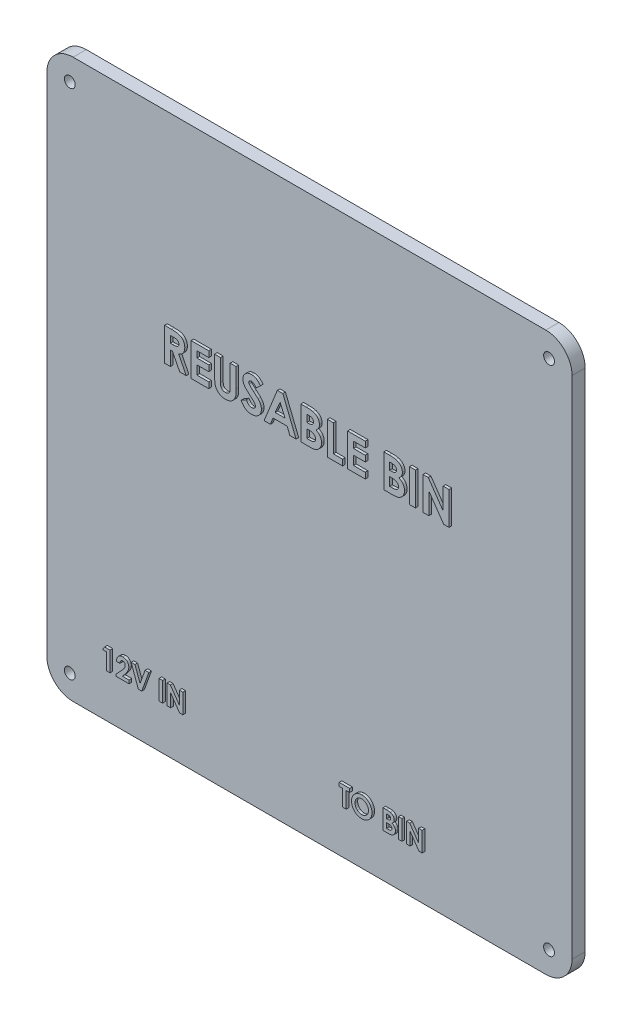
from build123d import *

# Parameters (mm, degrees)
LID_DEPTH           = 4
SKETCH2_R           = 1.65
SCREW_HOLES_DEPTH   = 188.92551716
SKETCH3_W           = 30
SKETCH3_H           = 2
SKETCH3_W_2         = 2
SKETCH3_H_2         = 30
LOCATING_TABS_DEPTH = 3
SKETCH4_W           = 1.794871795
SKETCH4_H           = 10
SKETCH4_W_2         = 1.076923077
SKETCH4_H_2         = 6
LABELS_RAISED_DEPTH = 0.8


with BuildPart() as part:
    # Sketch1 → Lid (new body)
    with BuildSketch(Plane.XY):
        with BuildLine():
            Line((-72, 0), (72, 0))
            ThreePointArc((72, 0), (77.656854249, 2.343145751), (80, 8))
            Line((80, 8), (80, 162))
            ThreePointArc((80, 162), (77.656854249, 167.656854249), (72, 170))
            Line((72, 170), (-72, 170))
            ThreePointArc((-72, 170), (-77.656854249, 167.656854249), (-80, 162))
            Line((-80, 162), (-80, 8))
            ThreePointArc((-80, 8), (-77.656854249, 2.343145751), (-72, 0))
        make_face()
    extrude(amount=LID_DEPTH)

    # Sketch2 → Screw holes (cut, through all)
    with BuildSketch(Plane.XY):
        with Locations((-73, 7)):
            Circle(SKETCH2_R)
        with Locations((73, 7)):
            Circle(SKETCH2_R)
        with Locations((-73, 163)):
            Circle(SKETCH2_R)
        with Locations((73, 163)):
            Circle(SKETCH2_R)
    extrude(amount=SCREW_HOLES_DEPTH, mode=Mode.SUBTRACT)

    # Sketch3 → Locating tabs (add)
    with BuildSketch(Plane.XY.offset(-3)):
        with Locations((0, 4.3)):
            Rectangle(SKETCH3_W, SKETCH3_H)
        with Locations((0, 165.7)):
            Rectangle(SKETCH3_W, SKETCH3_H)
        with Locations((-75.7, 85)):
            Rectangle(SKETCH3_W_2, SKETCH3_H_2)
        with Locations((75.7, 85)):
            Rectangle(SKETCH3_W_2, SKETCH3_H_2)
    extrude(amount=LOCATING_TABS_DEPTH)

    # Sketch4 → Labels (raised) (add)
    # profile 1 of 21: a face of its own
    with BuildSketch(Plane.XY.offset(4)):
        with BuildLine():
            Line((-43.333333333, 114), (-41.241987179, 114))
            add(Edge.make_bspline(
                [(-41.241987179, 114), (-41.103749835, 113.999509337), (-40.837880483, 113.998565653), (-40.454511399, 113.983676825), (-40.102334173, 113.9629578), (-39.780827375, 113.931340016), (-39.490128552, 113.889418657), (-39.229946354, 113.840000312), (-39.000288388, 113.783677513), (-38.799217805, 113.713494862), (-38.617761546, 113.634329895), (-38.448619086, 113.543367897), (-38.288058889, 113.441621757), (-38.137154129, 113.32641426), (-37.994593406, 113.19981796), (-37.860107772, 113.061705426), (-37.735597632, 112.91090552), (-37.62183396, 112.748371106), (-37.51814753, 112.577388629), (-37.426510473, 112.39772333), (-37.351991066, 112.209250263), (-37.286145181, 112.014693272), (-37.238718523, 111.811271126), (-37.205733977, 111.600964175), (-37.181583982, 111.383032114), (-37.180195473, 111.234978749), (-37.179487179, 111.159455128)],
                knots=[0, 0, 0, 0, 1.749336639, 3.364467119, 4.854658419, 6.213483162, 7.451590619, 8.570285859, 9.5643256, 10.440900261, 11.26203566, 12.067320669, 12.869050712, 13.665104639, 14.467235401, 15.27997916, 16.102287765, 16.939272006, 17.78853747, 18.631303466, 19.488103222, 20.351255419, 21.228522269, 22.127379805, 23.044756219, 24, 24, 24, 24], degree=3))
            add(Edge.make_bspline(
                [(-37.179487179, 111.159455128), (-37.181327071, 111.080625818), (-37.184934764, 110.926055908), (-37.20436776, 110.699005317), (-37.239885172, 110.481779192), (-37.293681459, 110.275013547), (-37.355513304, 110.07613494), (-37.437733797, 109.888812806), (-37.530527749, 109.710322818), (-37.640736416, 109.543189782), (-37.761685043, 109.383701341), (-37.902345752, 109.237968087), (-38.05360589, 109.098157412), (-38.223968339, 108.973026581), (-38.405923366, 108.854114699), (-38.603086224, 108.746348867), (-38.814170162, 108.647020099), (-38.962572624, 108.591627517), (-39.038461538, 108.563301282)],
                knots=[0, 0, 0, 0, 1.099860209, 2.156625411, 3.176576793, 4.16617041, 5.135385252, 6.078461593, 7.016046972, 7.938469504, 8.868247731, 9.803980173, 10.76021508, 11.73834243, 12.748633912, 13.790971185, 14.870363756, 16, 16, 16, 16], degree=3))
            Line((-39.038461538, 108.563301282), (-36.730769231, 104))
            Line((-36.730769231, 104), (-38.725961538, 104))
            Line((-38.725961538, 104), (-40.929487179, 108.358974359))
            Line((-40.929487179, 108.358974359), (-41.538461538, 108.358974359))
            Line((-41.538461538, 108.358974359), (-41.538461538, 104))
            Line((-41.538461538, 104), (-43.333333333, 104))
            Line((-43.333333333, 104), (-43.333333333, 114))
        make_face()
        with BuildLine():
            Line((-41.538461538, 110.153846154), (-40.839342949, 110.153846154))
            add(Edge.make_bspline(
                [(-40.839342949, 110.153846154), (-40.75386989, 110.154808809), (-40.590207348, 110.156652086), (-40.354839116, 110.165201972), (-40.14106863, 110.185802971), (-39.947977886, 110.211831563), (-39.774595269, 110.241885331), (-39.622467292, 110.284954206), (-39.489249893, 110.331103596), (-39.376521704, 110.388455316), (-39.280209331, 110.453676661), (-39.19704976, 110.52776973), (-39.128264872, 110.613523023), (-39.0716514, 110.708606135), (-39.027612274, 110.813860053), (-38.995467086, 110.928129328), (-38.97750268, 111.052715634), (-38.975435813, 111.138697148), (-38.974358974, 111.18349359)],
                knots=[0, 0, 0, 0, 1.688639943, 3.233382647, 4.650958383, 5.928841754, 7.082724185, 8.122798841, 9.049171256, 9.863274652, 10.613301712, 11.341792392, 12.054588806, 12.776240173, 13.521029143, 14.301969904, 15.115324896, 16, 16, 16, 16], degree=3))
            add(Edge.make_bspline(
                [(-38.974358974, 111.18349359), (-38.976394837, 111.23649105), (-38.980393912, 111.34059474), (-39.020077162, 111.49046755), (-39.083244324, 111.62918509), (-39.169829202, 111.7561206), (-39.278871599, 111.86740103), (-39.404006353, 111.965495615), (-39.547934173, 112.043061474), (-39.681200504, 112.094223088), (-39.802441716, 112.12483361), (-39.911858084, 112.1476443), (-40.038562897, 112.16381089), (-40.18265181, 112.180958437), (-40.343757536, 112.192077754), (-40.522758197, 112.200192638), (-40.719139705, 112.203512836), (-40.856036267, 112.204574245), (-40.927483974, 112.205128205)],
                knots=[0, 0, 0, 0, 1.020303359, 2.004196876, 2.966617323, 3.9489082, 4.950758222, 5.960522915, 7.003732012, 8.091992268, 8.70421221, 9.413913587, 10.24622431, 11.166358409, 12.212345909, 13.359657661, 14.621978493, 16, 16, 16, 16], degree=3))
            Line((-40.927483974, 112.205128205), (-41.538461538, 112.205128205))
            Line((-41.538461538, 112.205128205), (-41.538461538, 110.153846154))
        make_face(mode=Mode.SUBTRACT)
    # profile 2 of 21: a face of its own
    with BuildSketch(Plane.XY.offset(4)):
        Polygon((-35.256410256, 114), (-29.871794872, 114), (-29.871794872, 112.205128205), (-33.461538462, 112.205128205), (-33.461538462, 110.282051282), (-29.871794872, 110.282051282), (-29.871794872, 108.487179487), (-33.461538462, 108.487179487), (-33.461538462, 105.794871795), (-29.871794872, 105.794871795), (-29.871794872, 104), (-35.256410256, 104), align=None)
    # profile 3 of 21: a face of its own
    with BuildSketch(Plane.XY.offset(4)):
        with BuildLine():
            Line((-28.076923077, 114), (-26.282051282, 114))
            Line((-26.282051282, 114), (-26.282051282, 107.493589744))
            add(Edge.make_bspline(
                [(-26.282051282, 107.493589744), (-26.281953686, 107.426134104), (-26.28176518, 107.295844233), (-26.272328461, 107.108920926), (-26.263693213, 106.937099269), (-26.248112774, 106.780567371), (-26.225095126, 106.639258272), (-26.202806531, 106.512264253), (-26.172641123, 106.401858998), (-26.127307337, 106.276188913), (-26.057462854, 106.134991709), (-25.943340845, 105.987832744), (-25.811653809, 105.853528829), (-25.653819312, 105.741739338), (-25.476427295, 105.651311716), (-25.280452449, 105.584314856), (-25.066171029, 105.547073497), (-24.918007182, 105.541387922), (-24.841746795, 105.538461538)],
                knots=[0, 0, 0, 0, 1.155499968, 2.231836252, 3.205919964, 4.102923608, 4.924856345, 5.658536265, 6.31071849, 6.882491295, 7.94666036, 8.992281882, 10.060072772, 11.158554251, 12.289267114, 13.461410017, 14.693379945, 16, 16, 16, 16], degree=3))
            add(Edge.make_bspline(
                [(-24.841746795, 105.538461538), (-24.760729545, 105.54082568), (-24.602759623, 105.545435357), (-24.37554504, 105.590684323), (-24.165029439, 105.662736173), (-23.975670155, 105.765572525), (-23.807655631, 105.888839917), (-23.665434857, 106.029403371), (-23.553194745, 106.187543242), (-23.480040815, 106.333439316), (-23.438968486, 106.467723947), (-23.40818273, 106.587702169), (-23.385613364, 106.729264595), (-23.365137694, 106.890200422), (-23.352833394, 107.072176636), (-23.339491386, 107.27372976), (-23.334601417, 107.496238875), (-23.333767957, 107.651176147), (-23.333333333, 107.731971154)],
                knots=[0, 0, 0, 0, 1.261321664, 2.459363699, 3.594844139, 4.716940403, 5.803436589, 6.833651888, 7.818396249, 8.814403945, 9.360733334, 10.004355033, 10.743453831, 11.592799886, 12.532235708, 13.585170094, 14.740740724, 16, 16, 16, 16], degree=3))
            Line((-23.333333333, 107.731971154), (-23.333333333, 114))
            Line((-23.333333333, 114), (-21.538461538, 114))
            Line((-21.538461538, 114), (-21.538461538, 108.034455128))
            add(Edge.make_bspline(
                [(-21.538461538, 108.034455128), (-21.538710789, 107.913593474), (-21.539190074, 107.681188301), (-21.546550439, 107.347205712), (-21.562219326, 107.04216619), (-21.575379384, 106.765980603), (-21.600848602, 106.51902102), (-21.627381553, 106.300232852), (-21.661200082, 106.110391434), (-21.711520019, 105.894280051), (-21.798357333, 105.645435708), (-21.938350468, 105.358902234), (-22.116062692, 105.078368607), (-22.326109659, 104.80692089), (-22.563271899, 104.554754709), (-22.822291016, 104.333385442), (-23.099051842, 104.146130913), (-23.396446328, 103.997569721), (-23.714221376, 103.881703191), (-24.055521134, 103.803846719), (-24.420112861, 103.751245909), (-24.671943258, 103.746192954), (-24.801682692, 103.743589744)],
                knots=[0, 0, 0, 0, 1.170808336, 2.251350247, 3.235597562, 4.129743112, 4.929140599, 5.639994148, 6.264258765, 6.79612947, 7.788252245, 8.809469599, 9.879094798, 10.999557536, 12.129761673, 13.226370002, 14.293821979, 15.358369427, 16.438775801, 17.562147481, 18.744053101, 20, 20, 20, 20], degree=3))
            add(Edge.make_bspline(
                [(-24.801682692, 103.743589744), (-24.887884153, 103.745041693), (-25.057957868, 103.74790636), (-25.308081101, 103.773165241), (-25.54987434, 103.810387334), (-25.782883256, 103.864690535), (-26.00791658, 103.934840127), (-26.224914526, 104.02118939), (-26.433070678, 104.123256678), (-26.631220222, 104.240103194), (-26.819119318, 104.366452585), (-26.990849393, 104.506516205), (-27.152320082, 104.649935818), (-27.298866563, 104.802747132), (-27.431589532, 104.963345888), (-27.550215644, 105.132096055), (-27.654568662, 105.308982645), (-27.747273528, 105.497194028), (-27.826619845, 105.706296308), (-27.893511772, 105.943727341), (-27.951950133, 106.21320862), (-27.995378074, 106.515347273), (-28.034750101, 106.849147484), (-28.059670424, 107.215478854), (-28.072707366, 107.614351893), (-28.075482332, 107.890882302), (-28.076923077, 108.034455128)],
                knots=[0, 0, 0, 0, 1.001158378, 1.975264943, 2.917723546, 3.841610987, 4.75185031, 5.653588123, 6.552117133, 7.442167995, 8.324307438, 9.179605724, 10.014504199, 10.831958861, 11.636465792, 12.43274043, 13.225645099, 14.020104002, 14.867201867, 15.819789774, 16.883317127, 18.068162734, 19.364263498, 20.787406516, 22.332041935, 24, 24, 24, 24], degree=3))
            Line((-28.076923077, 108.034455128), (-28.076923077, 114))
        make_face()
    # profile 4 of 21: a face of its own
    with BuildSketch(Plane.XY.offset(4)):
        with BuildLine():
            Line((-14.102564103, 112.663862179), (-15.444711538, 111.435897436))
            add(Edge.make_bspline(
                [(-15.444711538, 111.435897436), (-15.50220338, 111.516995655), (-15.612579697, 111.672692925), (-15.791488195, 111.881175241), (-15.96958883, 112.059026171), (-16.148531595, 112.205502736), (-16.329902571, 112.319714983), (-16.513386924, 112.400578516), (-16.697944431, 112.451984231), (-16.821938587, 112.45838548), (-16.883012821, 112.461538462)],
                knots=[0, 0, 0, 0, 1.299362458, 2.494594718, 3.587462134, 4.587049575, 5.512617175, 6.380583204, 7.202344345, 8, 8, 8, 8], degree=3))
            add(Edge.make_bspline(
                [(-16.883012821, 112.461538462), (-16.939981114, 112.459540588), (-17.04997192, 112.455683218), (-17.206771975, 112.417341249), (-17.345981297, 112.351168643), (-17.467464023, 112.264642393), (-17.563696266, 112.160398321), (-17.640530249, 112.051073094), (-17.683794238, 111.930402767), (-17.68948863, 111.847521519), (-17.692307692, 111.806490385)],
                knots=[0, 0, 0, 0, 1.185010067, 2.2879431, 3.333075148, 4.379039566, 5.372662701, 6.27520591, 7.14612461, 8, 8, 8, 8], degree=3))
            add(Edge.make_bspline(
                [(-17.692307692, 111.806490385), (-17.690541129, 111.764867563), (-17.686983516, 111.681044985), (-17.65262182, 111.558192557), (-17.600828931, 111.438151434), (-17.551338712, 111.36507669), (-17.526041667, 111.327724359)],
                knots=[0, 0, 0, 0, 0.967525499, 1.948461899, 2.951351359, 4, 4, 4, 4], degree=3))
            add(Edge.make_bspline(
                [(-17.526041667, 111.327724359), (-17.503043916, 111.298690783), (-17.450106132, 111.231859325), (-17.349164621, 111.126008713), (-17.222403281, 110.996332448), (-17.064944071, 110.847289717), (-16.883323555, 110.67352036), (-16.669123387, 110.481855318), (-16.428509183, 110.266358945), (-16.257486182, 110.116295075), (-16.16786859, 110.037660256)],
                knots=[0, 0, 0, 0, 0.473873513, 1.090794244, 1.870441696, 2.795289791, 3.865433203, 5.087734844, 6.473946851, 8, 8, 8, 8], degree=3))
            add(Edge.make_bspline(
                [(-16.16786859, 110.037660256), (-16.083749588, 109.964859504), (-15.9241092, 109.8266988), (-15.696972629, 109.630601864), (-15.497357413, 109.454178233), (-15.322355613, 109.300075646), (-15.174620085, 109.166677216), (-15.053529749, 109.0533453), (-14.957605692, 108.962286261), (-14.903078483, 108.907286546), (-14.879807692, 108.883814103)],
                knots=[0, 0, 0, 0, 1.543621617, 2.929473131, 4.163658386, 5.240097082, 6.164993805, 6.925417477, 7.541396219, 8, 8, 8, 8], degree=3))
            add(Edge.make_bspline(
                [(-14.879807692, 108.883814103), (-14.791523165, 108.788271337), (-14.6218093, 108.604604587), (-14.401241103, 108.319978887), (-14.219706343, 108.042126168), (-14.07926761, 107.76581818), (-13.97320263, 107.487068348), (-13.898425414, 107.199040348), (-13.853640842, 106.898724467), (-13.848668709, 106.693795541), (-13.846153846, 106.590144231)],
                knots=[0, 0, 0, 0, 1.206664779, 2.319633467, 3.337109185, 4.282041471, 5.190008762, 6.099243693, 7.03861361, 8, 8, 8, 8], degree=3))
            add(Edge.make_bspline(
                [(-13.846153846, 106.590144231), (-13.847943861, 106.489148741), (-13.851455937, 106.290991831), (-13.89447213, 106.00101871), (-13.955810697, 105.723501848), (-14.050650882, 105.461461021), (-14.166241538, 105.210594909), (-14.31115112, 104.974811208), (-14.481327553, 104.751723691), (-14.676375876, 104.545320319), (-14.892122481, 104.358023566), (-15.12353122, 104.191287572), (-15.372864923, 104.053625771), (-15.637993322, 103.940271097), (-15.9187745, 103.852963811), (-16.214873963, 103.78843559), (-16.526744614, 103.749706769), (-16.740006259, 103.74565813), (-16.848958333, 103.743589744)],
                knots=[0, 0, 0, 0, 1.043214005, 2.046824704, 3.02475056, 3.976699089, 4.921714032, 5.875962561, 6.831408892, 7.817874052, 8.806269674, 9.781291748, 10.760897367, 11.74438705, 12.757449933, 13.795994037, 14.874007457, 16, 16, 16, 16], degree=3))
            add(Edge.make_bspline(
                [(-16.848958333, 103.743589744), (-16.934484784, 103.74510704), (-17.103876206, 103.748112156), (-17.353533553, 103.772646433), (-17.594605944, 103.812242144), (-17.826821832, 103.868994627), (-18.051227391, 103.940907721), (-18.267831836, 104.028746809), (-18.475139876, 104.133873366), (-18.674720102, 104.254125571), (-18.865602306, 104.393754221), (-19.05020012, 104.549904654), (-19.226679943, 104.724978534), (-19.395889372, 104.918561817), (-19.556745757, 105.131202685), (-19.714514505, 105.359939721), (-19.862183898, 105.609017972), (-19.953405851, 105.783748381), (-20, 105.872996795)],
                knots=[0, 0, 0, 0, 1.016823716, 2.013894106, 2.979844003, 3.91962641, 4.853723003, 5.779685073, 6.695824784, 7.614987388, 8.547259901, 9.504950863, 10.487499108, 11.500346958, 12.559593716, 13.656357062, 14.802919212, 16, 16, 16, 16], degree=3))
            Line((-20, 105.872996795), (-18.421474359, 106.820512821))
            add(Edge.make_bspline(
                [(-18.421474359, 106.820512821), (-18.363192043, 106.71920421), (-18.251459862, 106.524986944), (-18.062119235, 106.264031433), (-17.86814943, 106.040566233), (-17.665066037, 105.858541107), (-17.455338475, 105.715522145), (-17.23795371, 105.613310873), (-17.012759013, 105.550042211), (-16.859366616, 105.542315646), (-16.782852564, 105.538461538)],
                knots=[0, 0, 0, 0, 1.283663364, 2.460892379, 3.537111102, 4.529833553, 5.449777664, 6.316464042, 7.160231139, 8, 8, 8, 8], degree=3))
            add(Edge.make_bspline(
                [(-16.782852564, 105.538461538), (-16.705026819, 105.541609012), (-16.554033538, 105.547715568), (-16.338509951, 105.604119988), (-16.140909766, 105.692679066), (-15.970105625, 105.819040658), (-15.825479448, 105.964881141), (-15.718737028, 106.127135347), (-15.65168072, 106.30269048), (-15.644591242, 106.424642624), (-15.641025641, 106.485977564)],
                knots=[0, 0, 0, 0, 1.13588714, 2.203786484, 3.234766741, 4.283437687, 5.291419208, 6.222934724, 7.106237994, 8, 8, 8, 8], degree=3))
            add(Edge.make_bspline(
                [(-15.641025641, 106.485977564), (-15.644318328, 106.543039745), (-15.651007105, 106.658956103), (-15.700274579, 106.831305087), (-15.777294668, 107.00357569), (-15.868414864, 107.1448767), (-15.961141074, 107.263184205), (-16.049808245, 107.365692306), (-16.157781403, 107.478945813), (-16.284786778, 107.603087188), (-16.429146295, 107.73920928), (-16.59098156, 107.88729876), (-16.772145758, 108.046051136), (-16.90019297, 108.154191686), (-16.967147436, 108.210737179)],
                knots=[0, 0, 0, 0, 0.916159276, 1.861089862, 2.860218735, 3.940849679, 4.552606315, 5.27541173, 6.11797699, 7.06649574, 8.129236253, 9.306560635, 10.591630461, 12, 12, 12, 12], degree=3))
            add(Edge.make_bspline(
                [(-16.967147436, 108.210737179), (-17.09443054, 108.318430891), (-17.338725342, 108.52512772), (-17.683944892, 108.830412429), (-17.995018617, 109.115728962), (-18.26925975, 109.384604457), (-18.510162548, 109.632073404), (-18.716095512, 109.860145843), (-18.884796375, 110.070581039), (-19.062317657, 110.319827446), (-19.230998368, 110.62355132), (-19.37678637, 110.98896635), (-19.471367472, 111.354335014), (-19.481963969, 111.599623411), (-19.487179487, 111.720352564)],
                knots=[0, 0, 0, 0, 1.345494975, 2.582412109, 3.71882943, 4.751509156, 5.681369928, 6.505683931, 7.230279997, 7.856715994, 8.973648664, 10.023341002, 11.027102913, 12, 12, 12, 12], degree=3))
            add(Edge.make_bspline(
                [(-19.487179487, 111.720352564), (-19.48501036, 111.805967199), (-19.480736947, 111.974637228), (-19.44261744, 112.222641928), (-19.385646385, 112.461945626), (-19.302908057, 112.691675233), (-19.195523698, 112.911543002), (-19.065109565, 113.122625279), (-18.909640574, 113.322979311), (-18.734437517, 113.512472276), (-18.541408604, 113.685647283), (-18.335132681, 113.838491578), (-18.116777287, 113.967586092), (-17.887678209, 114.074679366), (-17.646415817, 114.156652463), (-17.394767479, 114.214759081), (-17.132372251, 114.249319044), (-16.953896681, 114.25401707), (-16.862980769, 114.256410256)],
                knots=[0, 0, 0, 0, 1.010766082, 1.991317756, 2.957454644, 3.913069143, 4.869106762, 5.843196583, 6.838735724, 7.860187025, 8.887984031, 9.89767229, 10.887916223, 11.879572884, 12.879850636, 13.892031539, 14.926195476, 16, 16, 16, 16], degree=3))
            add(Edge.make_bspline(
                [(-16.862980769, 114.256410256), (-16.745158247, 114.252100058), (-16.510443254, 114.243513683), (-16.163410366, 114.17637104), (-15.82444315, 114.070782161), (-15.551297015, 113.943400796), (-15.333959734, 113.820006407), (-15.16739101, 113.706400397), (-14.997898368, 113.576258607), (-14.824114954, 113.429170925), (-14.649269934, 113.262366027), (-14.468391627, 113.079814835), (-14.283944722, 112.879939678), (-14.164083478, 112.737149793), (-14.102564103, 112.663862179)],
                knots=[0, 0, 0, 0, 1.282922637, 2.555718331, 3.837320111, 5.142675274, 5.830281639, 6.55870424, 7.337177975, 8.157850921, 9.037902056, 9.96903443, 10.957596896, 12, 12, 12, 12], degree=3))
        make_face()
    # profile 5 of 21: a face of its own
    with BuildSketch(Plane.XY.offset(4)):
        Polygon((-8.976362179, 114), (-7.307692308, 114), (-3.269230769, 104), (-5.186298077, 104), (-5.963541667, 106.051282051), (-10.31650641, 106.051282051), (-11.095753205, 104), (-13.012820513, 104), align=None)
        Polygon((-8.141025641, 111.317708333), (-9.635416667, 107.846153846), (-6.64463141, 107.846153846), align=None, mode=Mode.SUBTRACT)
    # profile 6 of 21: a face of its own
    with BuildSketch(Plane.XY.offset(4)):
        with BuildLine():
            Line((-1.794871795, 104), (-1.794871795, 114))
            Line((-1.794871795, 114), (-0.192307692, 114))
            add(Edge.make_bspline(
                [(-0.192307692, 114), (-0.080118185, 114.000012804), (0.136966385, 114.000037578), (0.450162766, 113.98903915), (0.740625959, 113.97481145), (1.007431598, 113.958893963), (1.251033804, 113.931464952), (1.471062141, 113.902557771), (1.667956226, 113.867697492), (1.78968514, 113.836426741), (1.846955128, 113.821714744)],
                knots=[0, 0, 0, 0, 1.311965854, 2.538629056, 3.664479157, 4.713267157, 5.663616078, 6.530575999, 7.308677837, 8, 8, 8, 8], degree=3))
            add(Edge.make_bspline(
                [(1.846955128, 113.821714744), (1.922156438, 113.800963209), (2.069725549, 113.760242035), (2.28109161, 113.678003865), (2.481601802, 113.586590309), (2.671011308, 113.482304538), (2.848157079, 113.363887532), (3.0123659, 113.230399496), (3.16717935, 113.087198636), (3.307100355, 112.930293984), (3.433565891, 112.764495154), (3.543441767, 112.589845589), (3.63890982, 112.409015797), (3.715309269, 112.219730154), (3.772874819, 112.022860371), (3.814978021, 111.819247114), (3.842266598, 111.6082461), (3.844845011, 111.464695213), (3.846153846, 111.391826923)],
                knots=[0, 0, 0, 0, 1.099996261, 2.158545794, 3.195537121, 4.207578794, 5.205712374, 6.197378256, 7.190519799, 8.17788031, 9.159561366, 10.129234751, 11.085776129, 12.040971148, 13.00380137, 13.975669004, 14.972423361, 16, 16, 16, 16], degree=3))
            add(Edge.make_bspline(
                [(3.846153846, 111.391826923), (3.84273163, 111.298210297), (3.835995417, 111.113937472), (3.792964034, 110.843274031), (3.712273486, 110.587458176), (3.606691866, 110.341775317), (3.463133872, 110.107141852), (3.280842984, 109.883669345), (3.062771717, 109.664476741), (2.895499017, 109.53308556), (2.80849359, 109.46474359)],
                knots=[0, 0, 0, 0, 0.986156485, 1.941127874, 2.875419072, 3.804401753, 4.751181392, 5.761612777, 6.835722519, 8, 8, 8, 8], degree=3))
            add(Edge.make_bspline(
                [(2.80849359, 109.46474359), (2.878998614, 109.428751386), (3.017239461, 109.358180633), (3.213500851, 109.242183381), (3.395217474, 109.118805591), (3.563204093, 108.990529676), (3.713936996, 108.851917832), (3.853640198, 108.710957065), (3.975421468, 108.559570909), (4.08432195, 108.403155054), (4.178976479, 108.239444582), (4.261410137, 108.068715961), (4.33103889, 107.890385947), (4.390002319, 107.705362094), (4.43397726, 107.513008007), (4.462649857, 107.313254891), (4.484603389, 107.106784008), (4.486311168, 106.966141198), (4.487179487, 106.89463141)],
                knots=[0, 0, 0, 0, 1.164658916, 2.283573913, 3.35186032, 4.395461096, 5.390182219, 6.362969632, 7.312859996, 8.245001507, 9.165155236, 10.092416118, 11.032087915, 11.979892451, 12.947605196, 13.931445124, 14.948243989, 16, 16, 16, 16], degree=3))
            add(Edge.make_bspline(
                [(4.487179487, 106.89463141), (4.481544675, 106.758051804), (4.470424395, 106.488512499), (4.389118336, 106.092766895), (4.248159463, 105.717564168), (4.058880765, 105.364395535), (3.82565299, 105.043484647), (3.557507932, 104.762369496), (3.257145195, 104.524411761), (2.980024267, 104.36380875), (2.740336488, 104.256029111), (2.541807579, 104.189392942), (2.328591738, 104.127661295), (2.096783364, 104.084312058), (1.850584827, 104.04463407), (1.587595675, 104.020136058), (1.308307429, 104.003534359), (1.11648019, 104.001201938), (1.017628205, 104)],
                knots=[0, 0, 0, 0, 1.284142165, 2.534249414, 3.780121997, 5.041676246, 6.291546858, 7.49970053, 8.684500223, 9.883330709, 10.50184324, 11.153274765, 11.851151195, 12.587658647, 13.369265475, 14.195992086, 15.070362669, 16, 16, 16, 16], degree=3))
            Line((1.017628205, 104), (-1.794871795, 104))
        make_face()
        with BuildLine():
            Line((0, 112.205128205), (0, 110.025641026))
            Line((0, 110.025641026), (0.476762821, 110.025641026))
            add(Edge.make_bspline(
                [(0.476762821, 110.025641026), (0.541559171, 110.026206074), (0.666644605, 110.027296867), (0.847317246, 110.041345893), (1.015313625, 110.065314404), (1.169996567, 110.098756507), (1.312807, 110.141223102), (1.442832611, 110.192319561), (1.5595017, 110.254662795), (1.695044197, 110.347525793), (1.83832239, 110.484177852), (1.964448573, 110.681600064), (2.038736052, 110.908634858), (2.047009674, 111.068757373), (2.051282051, 111.151442308)],
                knots=[0, 0, 0, 0, 1.065314748, 2.056525647, 2.977365736, 3.853934255, 4.656397591, 5.425096493, 6.14721249, 6.826394842, 8.123232004, 9.372140726, 10.643011755, 12, 12, 12, 12], degree=3))
            add(Edge.make_bspline(
                [(2.051282051, 111.151442308), (2.047863367, 111.228890487), (2.041253478, 111.378633428), (1.966455538, 111.588885855), (1.850279549, 111.775212535), (1.713117466, 111.90273791), (1.583952711, 111.989833982), (1.473353922, 112.047183036), (1.351963446, 112.098521323), (1.217431294, 112.137775828), (1.070525717, 112.167231027), (0.911960319, 112.188862343), (0.741461519, 112.203585537), (0.623697636, 112.204602952), (0.562900641, 112.205128205)],
                knots=[0, 0, 0, 0, 1.347982417, 2.606269829, 3.849316587, 5.153353503, 5.842674298, 6.568177932, 7.326619318, 8.142485038, 9.012069166, 9.942760135, 10.937925643, 12, 12, 12, 12], degree=3))
            Line((0.562900641, 112.205128205), (0, 112.205128205))
        make_face(mode=Mode.SUBTRACT)
        with BuildLine():
            Line((0, 108.358974359), (0, 105.794871795))
            Line((0, 105.794871795), (0.516826923, 105.794871795))
            add(Edge.make_bspline(
                [(0.516826923, 105.794871795), (0.619004264, 105.79545553), (0.815452952, 105.796577834), (1.096865349, 105.810137936), (1.352739571, 105.83457763), (1.582397647, 105.86508862), (1.786191344, 105.906426239), (1.963431789, 105.958981723), (2.116549605, 106.01680191), (2.24462669, 106.088216706), (2.349258331, 106.171325819), (2.443677417, 106.256265328), (2.520660857, 106.354251078), (2.58157159, 106.46107681), (2.634289723, 106.574088896), (2.666085578, 106.697700419), (2.690293826, 106.828247828), (2.69162607, 106.918544648), (2.692307692, 106.96474359)],
                knots=[0, 0, 0, 0, 1.753078804, 3.370512758, 4.83203934, 6.162291463, 7.344201807, 8.395507345, 9.331626367, 10.147333109, 10.898971645, 11.62040215, 12.321813352, 13.025280112, 13.727906689, 14.453419512, 15.208716525, 16, 16, 16, 16], degree=3))
            add(Edge.make_bspline(
                [(2.692307692, 106.96474359), (2.69080452, 107.017572806), (2.687876746, 107.120469907), (2.663965574, 107.270865002), (2.620511165, 107.411268802), (2.565778216, 107.545271622), (2.489614409, 107.668075693), (2.399096328, 107.783930799), (2.289727378, 107.888913729), (2.166735613, 107.989374242), (2.023277897, 108.077332864), (1.859286922, 108.153652549), (1.673871801, 108.217391939), (1.466458191, 108.268141283), (1.237955376, 108.31121155), (0.986695538, 108.336929254), (0.714771256, 108.35605664), (0.526214533, 108.357979687), (0.428685897, 108.358974359)],
                knots=[0, 0, 0, 0, 0.845221588, 1.646264278, 2.427170338, 3.19324141, 3.95557735, 4.731569926, 5.540061037, 6.376114724, 7.268642756, 8.224665384, 9.265483498, 10.400594375, 11.639216012, 12.983232105, 14.439614077, 16, 16, 16, 16], degree=3))
            Line((0.428685897, 108.358974359), (0, 108.358974359))
        make_face(mode=Mode.SUBTRACT)
    # profile 7 of 21: a face of its own
    with BuildSketch(Plane.XY.offset(4)):
        Polygon((6.282051282, 114), (8.076923077, 114), (8.076923077, 105.794871795), (10.897435897, 105.794871795), (10.897435897, 104), (6.282051282, 104), align=None)
    # profile 8 of 21: a face of its own
    with BuildSketch(Plane.XY.offset(4)):
        Polygon((12.435897436, 114), (17.820512821, 114), (17.820512821, 112.205128205), (14.230769231, 112.205128205), (14.230769231, 110.282051282), (17.820512821, 110.282051282), (17.820512821, 108.487179487), (14.230769231, 108.487179487), (14.230769231, 105.794871795), (17.820512821, 105.794871795), (17.820512821, 104), (12.435897436, 104), align=None)
    # profile 9 of 21: a face of its own
    with BuildSketch(Plane.XY.offset(4)):
        with BuildLine():
            Line((23.461538462, 104), (23.461538462, 114))
            Line((23.461538462, 114), (25.064102564, 114))
            add(Edge.make_bspline(
                [(25.064102564, 114), (25.176292072, 114.000012804), (25.393376642, 114.000037578), (25.706573023, 113.98903915), (25.997036216, 113.97481145), (26.263841855, 113.958893963), (26.507444061, 113.931464952), (26.727472397, 113.902557771), (26.924366482, 113.867697492), (27.046095396, 113.836426741), (27.103365385, 113.821714744)],
                knots=[0, 0, 0, 0, 1.311965854, 2.538629056, 3.664479157, 4.713267157, 5.663616078, 6.530575999, 7.308677837, 8, 8, 8, 8], degree=3))
            add(Edge.make_bspline(
                [(27.103365385, 113.821714744), (27.178566694, 113.800963209), (27.326135806, 113.760242035), (27.537501866, 113.678003865), (27.738012058, 113.586590309), (27.927421565, 113.482304538), (28.104567336, 113.363887532), (28.268776157, 113.230399496), (28.423589606, 113.087198636), (28.563510612, 112.930293984), (28.689976147, 112.764495154), (28.799852023, 112.589845589), (28.895320077, 112.409015797), (28.971719526, 112.219730154), (29.029285075, 112.022860371), (29.071388278, 111.819247114), (29.098676854, 111.6082461), (29.101255267, 111.464695213), (29.102564103, 111.391826923)],
                knots=[0, 0, 0, 0, 1.099996261, 2.158545794, 3.195537121, 4.207578794, 5.205712374, 6.197378256, 7.190519799, 8.17788031, 9.159561366, 10.129234751, 11.085776129, 12.040971148, 13.00380137, 13.975669004, 14.972423361, 16, 16, 16, 16], degree=3))
            add(Edge.make_bspline(
                [(29.102564103, 111.391826923), (29.099141886, 111.298210297), (29.092405674, 111.113937472), (29.04937429, 110.843274031), (28.968683742, 110.587458176), (28.863102122, 110.341775317), (28.719544128, 110.107141852), (28.53725324, 109.883669345), (28.319181974, 109.664476741), (28.151909274, 109.53308556), (28.064903846, 109.46474359)],
                knots=[0, 0, 0, 0, 0.986156485, 1.941127874, 2.875419072, 3.804401753, 4.751181392, 5.761612777, 6.835722519, 8, 8, 8, 8], degree=3))
            add(Edge.make_bspline(
                [(28.064903846, 109.46474359), (28.135408871, 109.428751386), (28.273649718, 109.358180633), (28.469911107, 109.242183381), (28.65162773, 109.118805591), (28.819614349, 108.990529676), (28.970347253, 108.851917832), (29.110050455, 108.710957065), (29.231831725, 108.559570909), (29.340732207, 108.403155054), (29.435386736, 108.239444582), (29.517820393, 108.068715961), (29.587449146, 107.890385947), (29.646412575, 107.705362094), (29.690387517, 107.513008007), (29.719060113, 107.313254891), (29.741013646, 107.106784008), (29.742721424, 106.966141198), (29.743589744, 106.89463141)],
                knots=[0, 0, 0, 0, 1.164658916, 2.283573913, 3.35186032, 4.395461096, 5.390182219, 6.362969632, 7.312859996, 8.245001507, 9.165155236, 10.092416118, 11.032087915, 11.979892451, 12.947605196, 13.931445124, 14.948243989, 16, 16, 16, 16], degree=3))
            add(Edge.make_bspline(
                [(29.743589744, 106.89463141), (29.737954931, 106.758051804), (29.726834651, 106.488512499), (29.645528592, 106.092766895), (29.50456972, 105.717564168), (29.315291021, 105.364395535), (29.082063247, 105.043484647), (28.813918188, 104.762369496), (28.513555452, 104.524411761), (28.236434524, 104.36380875), (27.996746744, 104.256029111), (27.798217835, 104.189392942), (27.585001995, 104.127661295), (27.353193621, 104.084312058), (27.106995083, 104.04463407), (26.844005931, 104.020136058), (26.564717686, 104.003534359), (26.372890446, 104.001201938), (26.274038462, 104)],
                knots=[0, 0, 0, 0, 1.284142165, 2.534249414, 3.780121997, 5.041676246, 6.291546858, 7.49970053, 8.684500223, 9.883330709, 10.50184324, 11.153274765, 11.851151195, 12.587658647, 13.369265475, 14.195992086, 15.070362669, 16, 16, 16, 16], degree=3))
            Line((26.274038462, 104), (23.461538462, 104))
        make_face()
        with BuildLine():
            Line((25.256410256, 112.205128205), (25.256410256, 110.025641026))
            Line((25.256410256, 110.025641026), (25.733173077, 110.025641026))
            add(Edge.make_bspline(
                [(25.733173077, 110.025641026), (25.797969428, 110.026206074), (25.923054861, 110.027296867), (26.103727503, 110.041345893), (26.271723881, 110.065314404), (26.426406823, 110.098756507), (26.569217257, 110.141223102), (26.699242868, 110.192319561), (26.815911956, 110.254662795), (26.951454453, 110.347525793), (27.094732647, 110.484177852), (27.220858829, 110.681600064), (27.295146308, 110.908634858), (27.30341993, 111.068757373), (27.307692308, 111.151442308)],
                knots=[0, 0, 0, 0, 1.065314748, 2.056525647, 2.977365736, 3.853934255, 4.656397591, 5.425096493, 6.14721249, 6.826394842, 8.123232004, 9.372140726, 10.643011755, 12, 12, 12, 12], degree=3))
            add(Edge.make_bspline(
                [(27.307692308, 111.151442308), (27.304273623, 111.228890487), (27.297663735, 111.378633428), (27.222865794, 111.588885855), (27.106689806, 111.775212535), (26.969527722, 111.90273791), (26.840362968, 111.989833982), (26.729764178, 112.047183036), (26.608373703, 112.098521323), (26.47384155, 112.137775828), (26.326935974, 112.167231027), (26.168370576, 112.188862343), (25.997871776, 112.203585537), (25.880107892, 112.204602952), (25.819310897, 112.205128205)],
                knots=[0, 0, 0, 0, 1.347982417, 2.606269829, 3.849316587, 5.153353503, 5.842674298, 6.568177932, 7.326619318, 8.142485038, 9.012069166, 9.942760135, 10.937925643, 12, 12, 12, 12], degree=3))
            Line((25.819310897, 112.205128205), (25.256410256, 112.205128205))
        make_face(mode=Mode.SUBTRACT)
        with BuildLine():
            Line((25.256410256, 108.358974359), (25.256410256, 105.794871795))
            Line((25.256410256, 105.794871795), (25.773237179, 105.794871795))
            add(Edge.make_bspline(
                [(25.773237179, 105.794871795), (25.87541452, 105.79545553), (26.071863208, 105.796577834), (26.353275605, 105.810137936), (26.609149827, 105.83457763), (26.838807904, 105.86508862), (27.0426016, 105.906426239), (27.219842045, 105.958981723), (27.372959861, 106.01680191), (27.501036946, 106.088216706), (27.605668587, 106.171325819), (27.700087674, 106.256265328), (27.777071113, 106.354251078), (27.837981847, 106.46107681), (27.890699979, 106.574088896), (27.922495834, 106.697700419), (27.946704082, 106.828247828), (27.948036327, 106.918544648), (27.948717949, 106.96474359)],
                knots=[0, 0, 0, 0, 1.753078804, 3.370512758, 4.83203934, 6.162291463, 7.344201807, 8.395507345, 9.331626367, 10.147333109, 10.898971645, 11.62040215, 12.321813352, 13.025280112, 13.727906689, 14.453419512, 15.208716525, 16, 16, 16, 16], degree=3))
            add(Edge.make_bspline(
                [(27.948717949, 106.96474359), (27.947214777, 107.017572806), (27.944287002, 107.120469907), (27.92037583, 107.270865002), (27.876921421, 107.411268802), (27.822188472, 107.545271622), (27.746024666, 107.668075693), (27.655506584, 107.783930799), (27.546137634, 107.888913729), (27.42314587, 107.989374242), (27.279688153, 108.077332864), (27.115697179, 108.153652549), (26.930282058, 108.217391939), (26.722868447, 108.268141283), (26.494365633, 108.31121155), (26.243105795, 108.336929254), (25.971181512, 108.35605664), (25.782624789, 108.357979687), (25.685096154, 108.358974359)],
                knots=[0, 0, 0, 0, 0.845221588, 1.646264278, 2.427170338, 3.19324141, 3.95557735, 4.731569926, 5.540061037, 6.376114724, 7.268642756, 8.224665384, 9.265483498, 10.400594375, 11.639216012, 12.983232105, 14.439614077, 16, 16, 16, 16], degree=3))
            Line((25.685096154, 108.358974359), (25.256410256, 108.358974359))
        make_face(mode=Mode.SUBTRACT)
    # profile 10 of 21: a face of its own
    with BuildSketch(Plane.XY.offset(4)):
        with Locations((32.17948718, 109)):
            Rectangle(SKETCH4_W, SKETCH4_H)
    # profile 11 of 21: a face of its own
    with BuildSketch(Plane.XY.offset(4)):
        Polygon((35.384615385, 114), (37.001201923, 114), (41.538461538, 107.419471154), (41.538461538, 114), (43.333333333, 114), (43.333333333, 104), (41.704727564, 104), (37.179487179, 110.560496795), (37.179487179, 104), (35.384615385, 104), align=None)
    # profile 12 of 21: a face of its own
    with BuildSketch(Plane.XY.offset(4)):
        Polygon((-61.587740385, 20), (-59.923076923, 20), (-59.923076923, 14), (-61, 14), (-61, 19), (-62.230769231, 19), align=None)
    # profile 13 of 21: a face of its own
    with BuildSketch(Plane.XY.offset(4)):
        with BuildLine():
            Line((-56.923076923, 18), (-58, 18))
            add(Edge.make_bspline(
                [(-58, 18), (-57.995348934, 18.081463533), (-57.986261031, 18.240638387), (-57.95011165, 18.471844958), (-57.901672721, 18.690309743), (-57.837024538, 18.895268528), (-57.755789867, 19.086646839), (-57.660059085, 19.265097094), (-57.547386487, 19.429679748), (-57.420170117, 19.579601092), (-57.280569759, 19.714096912), (-57.131483654, 19.833349356), (-56.970631329, 19.931753472), (-56.800951686, 20.012730949), (-56.62247362, 20.07742819), (-56.433508447, 20.120683531), (-56.23569233, 20.149976472), (-56.10027118, 20.152539722), (-56.03125, 20.153846154)],
                knots=[0, 0, 0, 0, 1.199038563, 2.342849363, 3.436047546, 4.486744587, 5.497670872, 6.488682221, 7.459191391, 8.424610317, 9.374430501, 10.305433194, 11.225809216, 12.140057399, 13.06607119, 14.010487599, 14.985989317, 16, 16, 16, 16], degree=3))
            add(Edge.make_bspline(
                [(-56.03125, 20.153846154), (-55.946527481, 20.151202588), (-55.781129269, 20.146041728), (-55.540792548, 20.102017877), (-55.316344328, 20.028381184), (-55.107947761, 19.925491304), (-54.917376966, 19.794780496), (-54.744663543, 19.638929251), (-54.595030622, 19.454667726), (-54.467529485, 19.249662744), (-54.361591279, 19.03259132), (-54.287354197, 18.808130466), (-54.238558963, 18.582236463), (-54.233354649, 18.430130875), (-54.230769231, 18.354567308)],
                knots=[0, 0, 0, 0, 1.075374347, 2.099382735, 3.09057751, 4.06680945, 5.040638231, 6.016817125, 7.011024321, 8.044445721, 9.0776792, 10.070479129, 11.0414456, 12, 12, 12, 12], degree=3))
            add(Edge.make_bspline(
                [(-54.230769231, 18.354567308), (-54.231775856, 18.308861121), (-54.233801944, 18.216865859), (-54.247889602, 18.077654447), (-54.269023874, 17.935851349), (-54.300889205, 17.791578146), (-54.340627884, 17.644794397), (-54.388836647, 17.495060829), (-54.446633742, 17.343226377), (-54.513054653, 17.187582168), (-54.592294968, 17.027622888), (-54.6845593, 16.860950684), (-54.792296555, 16.687713408), (-54.914205401, 16.506932906), (-55.050877921, 16.318894297), (-55.202981304, 16.124164012), (-55.368763678, 15.922055882), (-55.486424092, 15.78695794), (-55.546875, 15.717548077)],
                knots=[0, 0, 0, 0, 0.728284026, 1.46585585, 2.227944881, 3.01186502, 3.81876927, 4.650621989, 5.517437689, 6.406905708, 7.346299482, 8.360816762, 9.441613733, 10.596154504, 11.834900912, 13.145207542, 14.533280747, 16, 16, 16, 16], degree=3))
            Line((-55.546875, 15.717548077), (-56.173076923, 15))
            Line((-56.173076923, 15), (-54.153846154, 15))
            Line((-54.153846154, 15), (-54.153846154, 14))
            Line((-54.153846154, 14), (-58.153846154, 14))
            Line((-58.153846154, 14), (-58.153846154, 14.545673077))
            Line((-58.153846154, 14.545673077), (-56.377403846, 16.436298077))
            add(Edge.make_bspline(
                [(-56.377403846, 16.436298077), (-56.325971276, 16.491448195), (-56.226361641, 16.598257619), (-56.084627395, 16.755118622), (-55.956370423, 16.903975969), (-55.844250237, 17.046414692), (-55.742382914, 17.177814657), (-55.65531071, 17.302136423), (-55.582236982, 17.418256077), (-55.502905086, 17.5582761), (-55.427565864, 17.725274894), (-55.358437567, 17.917664353), (-55.316299087, 18.101544366), (-55.310482644, 18.221364535), (-55.307692308, 18.278846154)],
                knots=[0, 0, 0, 0, 1.246127091, 2.413378631, 3.493388633, 4.492180848, 5.408488754, 6.240484944, 6.999099869, 7.674939598, 8.898438119, 10.020720584, 11.050475521, 12, 12, 12, 12], degree=3))
            add(Edge.make_bspline(
                [(-55.307692308, 18.278846154), (-55.309778575, 18.334455185), (-55.313821051, 18.442206598), (-55.358244594, 18.59548241), (-55.427067087, 18.734258011), (-55.5240477, 18.85438663), (-55.641521596, 18.953104281), (-55.777273718, 19.026527697), (-55.930197286, 19.068892671), (-56.037399621, 19.074195252), (-56.092548077, 19.076923077)],
                knots=[0, 0, 0, 0, 1.062038974, 2.057870785, 3.028805853, 4.01125022, 4.991535629, 5.949134679, 6.94496649, 8, 8, 8, 8], degree=3))
            add(Edge.make_bspline(
                [(-56.092548077, 19.076923077), (-56.121038472, 19.075915386), (-56.177126389, 19.073931584), (-56.259571244, 19.060725953), (-56.338023446, 19.037452406), (-56.413356213, 19.006269128), (-56.484765574, 18.96493547), (-56.55207141, 18.913985152), (-56.615982875, 18.854712936), (-56.676206845, 18.787304159), (-56.731018519, 18.712075943), (-56.779702048, 18.629715346), (-56.819955221, 18.540273491), (-56.855395578, 18.444931146), (-56.882728878, 18.342664258), (-56.90263091, 18.234084882), (-56.917761097, 18.119369662), (-56.921272746, 18.040513736), (-56.923076923, 18)],
                knots=[0, 0, 0, 0, 0.903469896, 1.778625579, 2.63899355, 3.493148037, 4.358286772, 5.247621495, 6.164656832, 7.118446693, 8.109501108, 9.111810964, 10.146451449, 11.215617525, 12.33435995, 13.498009769, 14.714554818, 16, 16, 16, 16], degree=3))
        make_face()
    # profile 14 of 21: a face of its own
    with BuildSketch(Plane.XY.offset(4)):
        Polygon((-53.5, 20), (-52.349759615, 20), (-50.807692308, 15.737980769), (-49.264423077, 20), (-48.115384615, 20), (-50.289663462, 14), (-51.328125, 14), align=None)
    # profile 15 of 21: a face of its own
    with BuildSketch(Plane.XY.offset(4)):
        with Locations((-44.461538461, 17)):
            Rectangle(SKETCH4_W_2, SKETCH4_H_2)
    # profile 16 of 21: a face of its own
    with BuildSketch(Plane.XY.offset(4)):
        Polygon((-42.538461538, 20), (-41.568509615, 20), (-38.846153846, 16.051682692), (-38.846153846, 20), (-37.769230769, 20), (-37.769230769, 14), (-38.746394231, 14), (-41.461538462, 17.936298077), (-41.461538462, 14), (-42.538461538, 14), align=None)
    # profile 17 of 21: a face of its own
    with BuildSketch(Plane.XY.offset(4)):
        Polygon((9.846153846, 20), (13.076923077, 20), (13.076923077, 18.923076923), (12, 18.923076923), (12, 14), (10.923076923, 14), (10.923076923, 18.923076923), (9.846153846, 18.923076923), align=None)
    # profile 18 of 21: a face of its own
    with BuildSketch(Plane.XY.offset(4)):
        with BuildLine():
            add(Edge.make_bspline(
                [(16.742788462, 20.153846154), (16.847105815, 20.151145191), (17.053051898, 20.145812878), (17.355924268, 20.101363888), (17.647797797, 20.028940632), (17.928540501, 19.928267067), (18.197449433, 19.796616443), (18.455473124, 19.63772114), (18.701687346, 19.448582105), (18.933569093, 19.233611639), (19.147869648, 18.999840645), (19.333561204, 18.748144608), (19.491912151, 18.485045226), (19.623153839, 18.209837517), (19.723118813, 17.920615535), (19.79326837, 17.618853931), (19.838335984, 17.304638552), (19.843519454, 17.090700708), (19.846153846, 16.981971154)],
                knots=[0, 0, 0, 0, 1.014329547, 2.002516266, 2.970391464, 3.935626869, 4.897733899, 5.877609409, 6.878433252, 7.912639331, 8.949961323, 9.958554974, 10.949718813, 11.932905612, 12.9188844, 13.919928257, 14.942845884, 16, 16, 16, 16], degree=3))
            add(Edge.make_bspline(
                [(19.846153846, 16.981971154), (19.843348332, 16.874466731), (19.837819976, 16.662625816), (19.795108227, 16.351306056), (19.723777343, 16.052776947), (19.625507853, 15.766362762), (19.496646393, 15.493450793), (19.341383462, 15.232298534), (19.155621968, 14.985329542), (18.94613736, 14.752676349), (18.715512986, 14.541493654), (18.471245164, 14.355389269), (18.21446177, 14.197691436), (17.945538654, 14.068472389), (17.663899123, 13.968190245), (17.370238861, 13.897433906), (17.064576039, 13.85443385), (16.856710497, 13.848941605), (16.751201923, 13.846153846)],
                knots=[0, 0, 0, 0, 1.051557043, 2.072126891, 3.067553643, 4.050577992, 5.02905126, 6.015227836, 7.017913613, 8.04756643, 9.074058332, 10.072836633, 11.047628519, 12.017157415, 12.98668631, 13.966869689, 14.968021931, 16, 16, 16, 16], degree=3))
            add(Edge.make_bspline(
                [(16.751201923, 13.846153846), (16.640852605, 13.848654603), (16.42403128, 13.853568248), (16.106712299, 13.900294773), (15.802693297, 13.970681242), (15.514528208, 14.07572927), (15.239282317, 14.207048139), (14.978977936, 14.3687752), (14.733702546, 14.560643185), (14.504863085, 14.777738284), (14.297533979, 15.015287939), (14.114525375, 15.266238084), (13.960153558, 15.528671681), (13.83441288, 15.802711553), (13.73528398, 16.08665461), (13.665359804, 16.382230147), (13.624053925, 16.688729266), (13.618300256, 16.896909595), (13.615384615, 17.002403846)],
                knots=[0, 0, 0, 0, 1.067978421, 2.098431617, 3.099715153, 4.085208694, 5.062210972, 6.048429807, 7.046490867, 8.072918869, 9.098532598, 10.095778865, 11.076610158, 12.041847152, 13.011192615, 13.984257998, 14.978533688, 16, 16, 16, 16], degree=3))
            add(Edge.make_bspline(
                [(13.615384615, 17.002403846), (13.616299711, 17.073374856), (13.618118316, 17.214418219), (13.640025326, 17.423437283), (13.671565122, 17.628376576), (13.718210983, 17.828419002), (13.774873782, 18.024975766), (13.848288443, 18.216217271), (13.931854195, 18.4041865), (14.029492907, 18.586663302), (14.138057715, 18.761968738), (14.256511586, 18.929275862), (14.385152371, 19.086561686), (14.523565676, 19.234859827), (14.672228491, 19.373195511), (14.82918531, 19.503527073), (14.997480183, 19.622392443), (15.173429662, 19.732694549), (15.356041784, 19.832438831), (15.544573153, 19.91733818), (15.73513965, 19.991479336), (15.930286986, 20.049994815), (16.127923811, 20.09765506), (16.330161473, 20.129173598), (16.535172871, 20.151080001), (16.673419027, 20.152921915), (16.742788462, 20.153846154)],
                knots=[0, 0, 0, 0, 1.034744296, 2.056386356, 3.06226378, 4.057406941, 5.050368692, 6.043467995, 7.042652155, 8.049140477, 9.059438543, 10.048523776, 11.036952808, 12.020949711, 13.004946614, 13.997082645, 14.994316842, 16.007702937, 17.024872941, 18.026463647, 19.021641123, 20.005082605, 20.995858141, 21.984425357, 22.988620895, 24, 24, 24, 24], degree=3))
        make_face()
        with BuildLine():
            add(Edge.make_bspline(
                [(16.725961538, 19.076923077), (16.655755973, 19.075039304), (16.517198282, 19.07132149), (16.313959382, 19.042996776), (16.11884286, 18.997758988), (15.932930326, 18.932232606), (15.755416016, 18.848834151), (15.585985255, 18.747855029), (15.426984306, 18.625824195), (15.276293048, 18.489292941), (15.140168292, 18.337165746), (15.019897776, 18.174135586), (14.919250726, 18.000474717), (14.834958191, 17.817796407), (14.771504594, 17.624046488), (14.7263085, 17.420742624), (14.697746255, 17.207534511), (14.694145948, 17.062190819), (14.692307692, 16.987980769)],
                knots=[0, 0, 0, 0, 1.033739768, 2.040188636, 3.016340934, 3.979330865, 4.937572243, 5.900995986, 6.878200029, 7.884839167, 8.891893314, 9.879764717, 10.863503415, 11.843163062, 12.837761627, 13.859916423, 14.907309254, 16, 16, 16, 16], degree=3))
            add(Edge.make_bspline(
                [(14.692307692, 16.987980769), (14.694744939, 16.905739341), (14.699521539, 16.744559769), (14.733130277, 16.509435351), (14.790631483, 16.287383675), (14.873662106, 16.079490762), (14.976641862, 15.883448116), (15.104526375, 15.70165852), (15.255244522, 15.533033501), (15.371356561, 15.434583191), (15.430288462, 15.384615385)],
                knots=[0, 0, 0, 0, 1.078454662, 2.113592447, 3.107694534, 4.079536787, 5.043276885, 6.005368276, 6.987637804, 8, 8, 8, 8], degree=3))
            add(Edge.make_bspline(
                [(15.430288462, 15.384615385), (15.478564939, 15.347701088), (15.574030217, 15.274704181), (15.726413584, 15.18114367), (15.883338447, 15.100952979), (16.045989001, 15.036159849), (16.214021734, 14.985194662), (16.387413606, 14.949504579), (16.565918935, 14.927105966), (16.686632603, 14.924428907), (16.747596154, 14.923076923)],
                knots=[0, 0, 0, 0, 1.023928204, 2.024787132, 3.009472467, 3.9914905, 4.972207045, 5.96565515, 6.972602802, 8, 8, 8, 8], degree=3))
            add(Edge.make_bspline(
                [(16.747596154, 14.923076923), (16.816594532, 14.924976668), (16.952351012, 14.928714477), (17.151806511, 14.956690498), (17.342890936, 15.004036027), (17.526790556, 15.068987589), (17.702975088, 15.153433183), (17.870583468, 15.257544361), (18.029909561, 15.38004277), (18.180408841, 15.518366979), (18.317972298, 15.67109345), (18.437991834, 15.834993196), (18.541838957, 16.006455017), (18.624378628, 16.187905695), (18.690339133, 16.377632419), (18.734991269, 16.57647545), (18.7637948, 16.78361508), (18.767396121, 16.924580918), (18.769230769, 16.996394231)],
                knots=[0, 0, 0, 0, 1.026359118, 2.019393844, 2.989460624, 3.950973911, 4.916101784, 5.890408035, 6.881132271, 7.902007068, 8.92769091, 9.933912415, 10.920395702, 11.90457117, 12.894218921, 13.903490204, 14.931958862, 16, 16, 16, 16], degree=3))
            add(Edge.make_bspline(
                [(18.769230769, 16.996394231), (18.767332642, 17.067794597), (18.763596467, 17.20833533), (18.735571206, 17.414942405), (18.68852593, 17.612907602), (18.623379326, 17.802554218), (18.540190561, 17.984068178), (18.437319214, 18.156811172), (18.315126248, 18.320616198), (18.176423927, 18.474366989), (18.025454974, 18.615654117), (17.863374719, 18.738265661), (17.694718349, 18.844811194), (17.515616064, 18.928274662), (17.329732146, 18.99476983), (17.135932322, 19.043737826), (16.933482564, 19.071122508), (16.795751807, 19.074972319), (16.725961538, 19.076923077)],
                knots=[0, 0, 0, 0, 1.055025985, 2.07665775, 3.074803781, 4.057872707, 5.035505728, 6.020516407, 7.023567878, 8.050795229, 9.077271434, 10.074415901, 11.050397877, 12.019801805, 12.988065821, 13.964604439, 14.968634123, 16, 16, 16, 16], degree=3))
        make_face(mode=Mode.SUBTRACT)
    # profile 19 of 21: a face of its own
    with BuildSketch(Plane.XY.offset(4)):
        with BuildLine():
            Line((23.230769231, 14), (23.230769231, 20))
            Line((23.230769231, 20), (24.192307692, 20))
            add(Edge.make_bspline(
                [(24.192307692, 20), (24.259621397, 20.000007682), (24.389872139, 20.000022547), (24.577789968, 19.99342349), (24.752067883, 19.98488687), (24.912151267, 19.975336378), (25.05831259, 19.958878971), (25.190329592, 19.941534662), (25.308466043, 19.920618495), (25.381503391, 19.901856045), (25.415865385, 19.893028846)],
                knots=[0, 0, 0, 0, 1.311965854, 2.538629056, 3.664479157, 4.713267157, 5.663616078, 6.530575999, 7.308677837, 8, 8, 8, 8], degree=3))
            add(Edge.make_bspline(
                [(25.415865385, 19.893028846), (25.46098617, 19.880577925), (25.549527637, 19.856145221), (25.676347273, 19.806802319), (25.796653389, 19.751954185), (25.910299093, 19.689382723), (26.016586555, 19.618332519), (26.115111848, 19.538239698), (26.207999918, 19.452319182), (26.291952521, 19.35817639), (26.367831842, 19.258697092), (26.433757368, 19.153907354), (26.4910382, 19.045409478), (26.536877869, 18.931838092), (26.571417199, 18.813716223), (26.596679121, 18.691548268), (26.613052266, 18.56494766), (26.614599314, 18.478817128), (26.615384615, 18.435096154)],
                knots=[0, 0, 0, 0, 1.099996261, 2.158545794, 3.195537121, 4.207578794, 5.205712374, 6.197378256, 7.190519799, 8.17788031, 9.159561366, 10.129234751, 11.085776129, 12.040971148, 13.00380137, 13.975669004, 14.972423361, 16, 16, 16, 16], degree=3))
            add(Edge.make_bspline(
                [(26.615384615, 18.435096154), (26.613331286, 18.378926178), (26.609289558, 18.268362483), (26.583470728, 18.105964419), (26.535056399, 17.952474905), (26.471707427, 17.80506519), (26.385572631, 17.664285111), (26.276198098, 17.530201607), (26.145355338, 17.398686045), (26.044991718, 17.319851336), (25.992788462, 17.278846154)],
                knots=[0, 0, 0, 0, 0.986156485, 1.941127874, 2.875419072, 3.804401753, 4.751181392, 5.761612777, 6.835722519, 8, 8, 8, 8], degree=3))
            add(Edge.make_bspline(
                [(25.992788462, 17.278846154), (26.035091476, 17.257250832), (26.118035984, 17.21490838), (26.235792818, 17.145310028), (26.344822792, 17.071283355), (26.445614763, 16.994317806), (26.536054505, 16.911150699), (26.619876427, 16.826574239), (26.692945189, 16.735742545), (26.758285478, 16.641893033), (26.815078195, 16.543666749), (26.86453839, 16.441229577), (26.906315642, 16.334231568), (26.941693699, 16.223217256), (26.968078664, 16.107804804), (26.985282222, 15.987952935), (26.998454341, 15.864070405), (26.999479008, 15.779684719), (27, 15.736778846)],
                knots=[0, 0, 0, 0, 1.164658916, 2.283573913, 3.35186032, 4.395461096, 5.390182219, 6.362969632, 7.312859996, 8.245001507, 9.165155236, 10.092416118, 11.032087915, 11.979892451, 12.947605196, 13.931445124, 14.948243989, 16, 16, 16, 16], degree=3))
            add(Edge.make_bspline(
                [(27, 15.736778846), (26.996619113, 15.654831082), (26.989946945, 15.493107499), (26.941163309, 15.255660137), (26.856587986, 15.030538501), (26.743020767, 14.818637321), (26.603084102, 14.626090788), (26.442197067, 14.457421697), (26.261979425, 14.314647056), (26.095706868, 14.21828525), (25.951894201, 14.153617467), (25.832776855, 14.113635765), (25.704847351, 14.076596777), (25.565762326, 14.050587235), (25.418043204, 14.026780442), (25.260249713, 14.012081635), (25.092676765, 14.002120616), (24.977580422, 14.000721163), (24.918269231, 14)],
                knots=[0, 0, 0, 0, 1.284142165, 2.534249414, 3.780121997, 5.041676246, 6.291546858, 7.49970053, 8.684500223, 9.883330709, 10.50184324, 11.153274765, 11.851151195, 12.587658647, 13.369265475, 14.195992086, 15.070362669, 16, 16, 16, 16], degree=3))
            Line((24.918269231, 14), (23.230769231, 14))
        make_face()
        with BuildLine():
            Line((24.307692308, 18.923076923), (24.307692308, 17.615384615))
            Line((24.307692308, 17.615384615), (24.59375, 17.615384615))
            add(Edge.make_bspline(
                [(24.59375, 17.615384615), (24.63262781, 17.615723645), (24.707679071, 17.61637812), (24.816082655, 17.624807536), (24.916880483, 17.639188643), (25.009690248, 17.659253904), (25.095376508, 17.684733861), (25.173391874, 17.715391736), (25.243393328, 17.752797677), (25.324718826, 17.808515476), (25.410685742, 17.890506711), (25.486361451, 18.008960039), (25.530933939, 18.145180915), (25.535898112, 18.241254424), (25.538461538, 18.290865385)],
                knots=[0, 0, 0, 0, 1.065314748, 2.056525647, 2.977365736, 3.853934255, 4.656397591, 5.425096493, 6.14721249, 6.826394842, 8.123232004, 9.372140726, 10.643011755, 12, 12, 12, 12], degree=3))
            add(Edge.make_bspline(
                [(25.538461538, 18.290865385), (25.536410328, 18.337334292), (25.532444395, 18.427180057), (25.487565631, 18.553331513), (25.417860037, 18.665127521), (25.335562787, 18.741642746), (25.258063934, 18.793900389), (25.191704661, 18.828309821), (25.118870375, 18.859112794), (25.038151084, 18.882665497), (24.950007738, 18.900338616), (24.854868499, 18.913317406), (24.752569219, 18.922151322), (24.681910889, 18.922761771), (24.645432692, 18.923076923)],
                knots=[0, 0, 0, 0, 1.347982417, 2.606269829, 3.849316587, 5.153353503, 5.842674298, 6.568177932, 7.326619318, 8.142485038, 9.012069166, 9.942760135, 10.937925643, 12, 12, 12, 12], degree=3))
            Line((24.645432692, 18.923076923), (24.307692308, 18.923076923))
        make_face(mode=Mode.SUBTRACT)
        with BuildLine():
            Line((24.307692308, 16.615384615), (24.307692308, 15.076923077))
            Line((24.307692308, 15.076923077), (24.617788462, 15.076923077))
            add(Edge.make_bspline(
                [(24.617788462, 15.076923077), (24.679094866, 15.077273318), (24.796964079, 15.077946701), (24.965811517, 15.086082762), (25.11933605, 15.100746578), (25.257130896, 15.119053172), (25.379407114, 15.143855743), (25.485751381, 15.175389034), (25.577622071, 15.210081146), (25.654468322, 15.252930024), (25.717247306, 15.302795491), (25.773898758, 15.353759197), (25.820088822, 15.412550647), (25.856635262, 15.476646086), (25.888266141, 15.544453338), (25.907343654, 15.618620251), (25.921868603, 15.696948697), (25.92266795, 15.751126789), (25.923076923, 15.778846154)],
                knots=[0, 0, 0, 0, 1.753078804, 3.370512758, 4.83203934, 6.162291463, 7.344201807, 8.395507345, 9.331626367, 10.147333109, 10.898971645, 11.62040215, 12.321813352, 13.025280112, 13.727906689, 14.453419512, 15.208716525, 16, 16, 16, 16], degree=3))
            add(Edge.make_bspline(
                [(25.923076923, 15.778846154), (25.92217502, 15.810543684), (25.920418355, 15.872281944), (25.906071652, 15.962519001), (25.879999006, 16.046761281), (25.847159237, 16.127162973), (25.801460953, 16.200845416), (25.747150104, 16.270358479), (25.681528735, 16.333348237), (25.607733676, 16.393624545), (25.521659046, 16.446399718), (25.423264461, 16.492191529), (25.312015388, 16.530435163), (25.187567222, 16.56088477), (25.050465534, 16.58672693), (24.899709631, 16.602157552), (24.736555061, 16.613633984), (24.623421027, 16.614787812), (24.564903846, 16.615384615)],
                knots=[0, 0, 0, 0, 0.845221588, 1.646264278, 2.427170338, 3.19324141, 3.95557735, 4.731569926, 5.540061037, 6.376114724, 7.268642756, 8.224665384, 9.265483498, 10.400594375, 11.639216012, 12.983232105, 14.439614077, 16, 16, 16, 16], degree=3))
            Line((24.564903846, 16.615384615), (24.307692308, 16.615384615))
        make_face(mode=Mode.SUBTRACT)
    # profile 20 of 21: a face of its own
    with BuildSketch(Plane.XY.offset(4)):
        with Locations((28.461538462, 17)):
            Rectangle(SKETCH4_W_2, SKETCH4_H_2)
    # profile 21 of 21: a face of its own
    with BuildSketch(Plane.XY.offset(4)):
        Polygon((30.384615385, 20), (31.354567308, 20), (34.076923077, 16.051682692), (34.076923077, 20), (35.153846154, 20), (35.153846154, 14), (34.176682692, 14), (31.461538462, 17.936298077), (31.461538462, 14), (30.384615385, 14), align=None)
    extrude(amount=LABELS_RAISED_DEPTH)


solid = part.part
